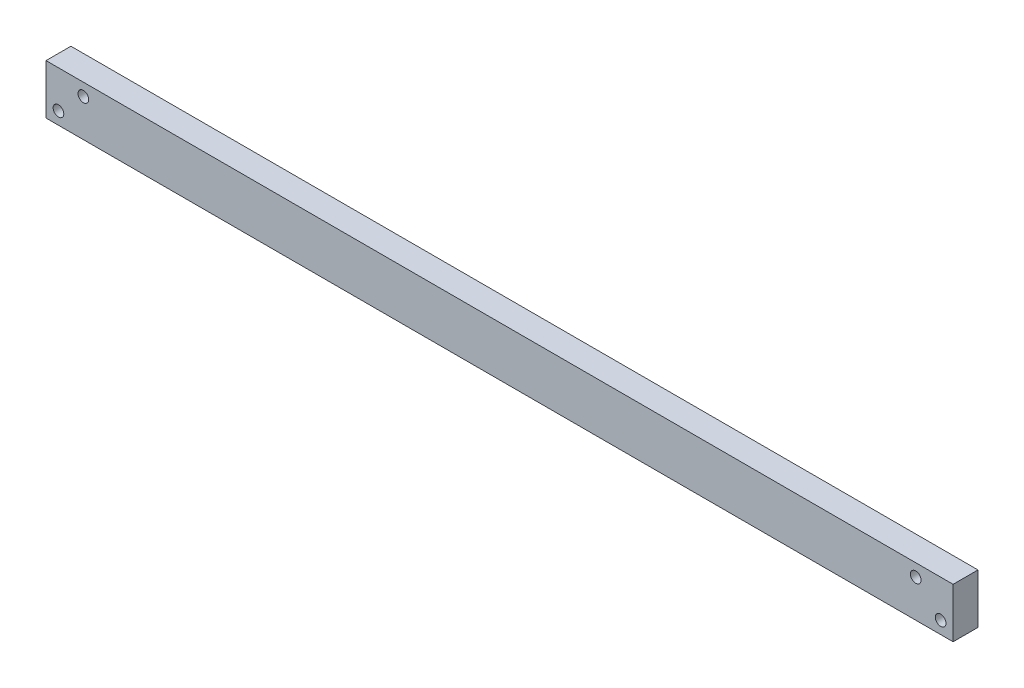
from build123d import *

# Parameters (mm, degrees)
IZIM1_W                     = 510
IZIM1_H                     = 28
Y_KSEKLIK_EKSTR_ZYON1_DEPTH = 14
KES_EKSTR_ZYON1_REACH       = 257.767
IZIM2_R                     = 3


with BuildPart() as part:
    # Çizim1 → Yükseklik-Ekstrüzyon1 (new body)
    with BuildSketch(Plane.XY):
        Rectangle(IZIM1_W, IZIM1_H)
    extrude(amount=Y_KSEKLIK_EKSTR_ZYON1_DEPTH)

    # Çizim2 → Kes-Ekstrüzyon1 (cut, up to next)
    with BuildSketch(Plane.XY.offset(14), mode=Mode.PRIVATE) as kes_ekstr_zyon1_sk1:
        with Locations((-234, 7)):
            Circle(IZIM2_R)
    kes_ekstr_zyon1_tool1 = extrude(kes_ekstr_zyon1_sk1.sketch, amount=-KES_EKSTR_ZYON1_REACH, mode=Mode.PRIVATE) & part.part
    # Çizim2 → Kes-Ekstrüzyon1 (cut, up to next)
    with BuildSketch(Plane.XY.offset(14), mode=Mode.PRIVATE) as kes_ekstr_zyon1_sk2:
        with Locations((-248, -7)):
            Circle(IZIM2_R)
    kes_ekstr_zyon1_tool2 = extrude(kes_ekstr_zyon1_sk2.sketch, amount=-KES_EKSTR_ZYON1_REACH, mode=Mode.PRIVATE) & part.part
    # Çizim2 → Kes-Ekstrüzyon1 (cut, up to next)
    with BuildSketch(Plane.XY.offset(14), mode=Mode.PRIVATE) as kes_ekstr_zyon1_sk3:
        with Locations((248, -7)):
            Circle(IZIM2_R)
    kes_ekstr_zyon1_tool3 = extrude(kes_ekstr_zyon1_sk3.sketch, amount=-KES_EKSTR_ZYON1_REACH, mode=Mode.PRIVATE) & part.part
    # Çizim2 → Kes-Ekstrüzyon1 (cut, up to next)
    with BuildSketch(Plane.XY.offset(14), mode=Mode.PRIVATE) as kes_ekstr_zyon1_sk4:
        with Locations((234, 7)):
            Circle(IZIM2_R)
    kes_ekstr_zyon1_tool4 = extrude(kes_ekstr_zyon1_sk4.sketch, amount=-KES_EKSTR_ZYON1_REACH, mode=Mode.PRIVATE) & part.part
    add(kes_ekstr_zyon1_tool1.solids().sort_by_distance((-234, 7, 14))[0], mode=Mode.SUBTRACT)
    add(kes_ekstr_zyon1_tool2.solids().sort_by_distance((-248, -7, 14))[0], mode=Mode.SUBTRACT)
    add(kes_ekstr_zyon1_tool3.solids().sort_by_distance((248, -7, 14))[0], mode=Mode.SUBTRACT)
    add(kes_ekstr_zyon1_tool4.solids().sort_by_distance((234, 7, 14))[0], mode=Mode.SUBTRACT)


solid = part.part
